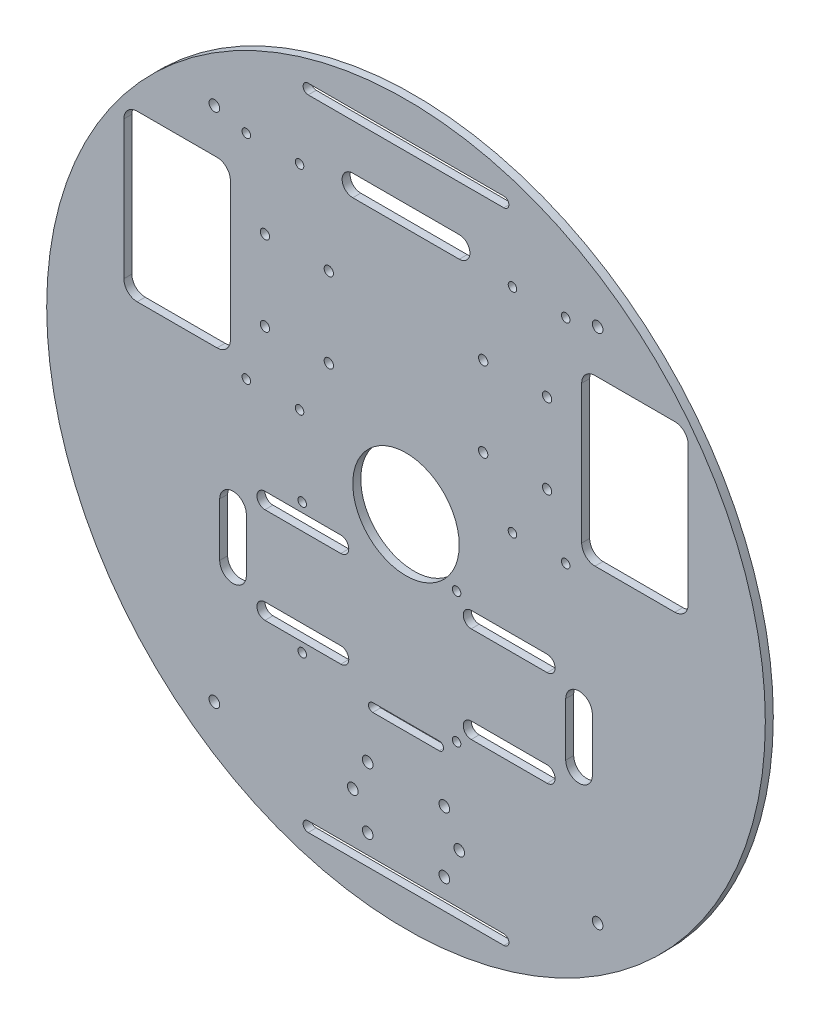
from build123d import *

# Parameters (mm, degrees)
SKETCH_1_R          = 135
SKETCH_1_R_2        = 2
SKETCH_1_W          = 40
SKETCH_1_H          = 62
SKETCH_1_R_3        = 1.75
EXTRUDE_1_DEPTH     = 3
FILLET_1_R          = 5
SKETCH_2_R          = 20
SKETCH_2_R_2        = 2
SKETCH_2_R_3        = 1.6
CUT_EXTRUDE_1_DEPTH = 10


with BuildPart() as part:
    # 草图1 → 凸台-拉伸1 (new body)
    with BuildSketch(Plane.XY):
        Circle(SKETCH_1_R)
        with Locations((-14.4, -110.804246301)):
            Circle(SKETCH_1_R_2, mode=Mode.SUBTRACT)
        with Locations((-20, -99.304246301)):
            Circle(SKETCH_1_R_2, mode=Mode.SUBTRACT)
        with Locations((-14.4, -87.804246301)):
            Circle(SKETCH_1_R_2, mode=Mode.SUBTRACT)
        with Locations((14.4, -110.804246301)):
            Circle(SKETCH_1_R_2, mode=Mode.SUBTRACT)
        with Locations((14.4, -87.804246301)):
            Circle(SKETCH_1_R_2, mode=Mode.SUBTRACT)
        with Locations((20, -99.304246301)):
            Circle(SKETCH_1_R_2, mode=Mode.SUBTRACT)
        with Locations((-86, 49.65212315)):
            Rectangle(SKETCH_1_W, SKETCH_1_H, mode=Mode.SUBTRACT)
        with Locations((-53, 34.65212315)):
            Circle(SKETCH_1_R_3, mode=Mode.SUBTRACT)
        with Locations((-53, 64.65212315)):
            Circle(SKETCH_1_R_3, mode=Mode.SUBTRACT)
        with Locations((-29, 34.65212315)):
            Circle(SKETCH_1_R_3, mode=Mode.SUBTRACT)
        with Locations((-29, 64.65212315)):
            Circle(SKETCH_1_R_3, mode=Mode.SUBTRACT)
        with Locations((29, 34.65212315)):
            Circle(SKETCH_1_R_3, mode=Mode.SUBTRACT)
        with Locations((29, 64.65212315)):
            Circle(SKETCH_1_R_3, mode=Mode.SUBTRACT)
        with Locations((53, 34.65212315)):
            Circle(SKETCH_1_R_3, mode=Mode.SUBTRACT)
        with Locations((53, 64.65212315)):
            Circle(SKETCH_1_R_3, mode=Mode.SUBTRACT)
        with Locations((86, 49.65212315)):
            Rectangle(SKETCH_1_W, SKETCH_1_H, mode=Mode.SUBTRACT)
    extrude(amount=EXTRUDE_1_DEPTH)

    # 圆角1
    fillet_1_edges = [part.edges().sort_by_distance(p)[0] for p in [
        (66, 80.65212315, 1.5),
        (66, 18.65212315, 1.5),
        (106, 18.65212315, 1.5),
        (106, 80.65212315, 1.5),
        (-106, 80.65212315, 1.5),
        (-106, 18.65212315, 1.5),
        (-66, 18.65212315, 1.5),
        (-66, 80.65212315, 1.5),
    ]]
    fillet(fillet_1_edges, radius=FILLET_1_R)

    # 草图2 → 切除-拉伸1 (cut)
    with BuildSketch(Plane.XY.offset(3)):
        Circle(SKETCH_2_R)
        with Locations((-72, 97)):
            Circle(SKETCH_2_R_2)
        with Locations((72, 97)):
            Circle(SKETCH_2_R_2)
        with Locations((72, -97)):
            Circle(SKETCH_2_R_2)
        with Locations((-72, -97)):
            Circle(SKETCH_2_R_2)
        with Locations((-60, 94)):
            Circle(SKETCH_2_R_3)
        with Locations((-60, 14)):
            Circle(SKETCH_2_R_3)
        with Locations((-40, 94)):
            Circle(SKETCH_2_R_3)
        with Locations((-40, 14)):
            Circle(SKETCH_2_R_3)
        with Locations((60, 14)):
            Circle(SKETCH_2_R_3)
        with Locations((60, 94)):
            Circle(SKETCH_2_R_3)
        with Locations((40, 94)):
            Circle(SKETCH_2_R_3)
        with Locations((40, 14)):
            Circle(SKETCH_2_R_3)
        with Locations((-39, -15.5)):
            Circle(SKETCH_2_R_3)
        with Locations((19, -15.5)):
            Circle(SKETCH_2_R_3)
        with Locations((-39, -64.5)):
            Circle(SKETCH_2_R_3)
        with Locations((19, -64.5)):
            Circle(SKETCH_2_R_3)
        with BuildLine():
            Line((24.505636669, -55), (53, -55))
            ThreePointArc((53, -55), (56, -58), (53, -61))
            Line((53, -61), (24.505636669, -61))
            ThreePointArc((24.505636669, -61), (21.505636669, -58), (24.505636669, -55))
        make_face()
        with BuildLine():
            Line((-53, -19), (-24.505636669, -19))
            ThreePointArc((-24.505636669, -19), (-21.505636669, -22), (-24.505636669, -25))
            Line((-24.505636669, -25), (-53, -25))
            ThreePointArc((-53, -25), (-56, -22), (-53, -19))
        make_face()
        with BuildLine():
            Line((-53, -61), (-24.505636669, -61))
            ThreePointArc((-24.505636669, -61), (-21.505636669, -58), (-24.505636669, -55))
            Line((-24.505636669, -55), (-53, -55))
            ThreePointArc((-53, -55), (-56, -58), (-53, -61))
        make_face()
        with BuildLine():
            Line((24.505636669, -25), (53, -25))
            ThreePointArc((53, -25), (56, -22), (53, -19))
            Line((53, -19), (24.505636669, -19))
            ThreePointArc((24.505636669, -19), (21.505636669, -22), (24.505636669, -25))
        make_face()
        with BuildLine():
            Line((-70, -30), (-70, -50))
            ThreePointArc((-70, -50), (-65, -55), (-60, -50))
            Line((-60, -50), (-60, -30))
            ThreePointArc((-60, -30), (-65, -25), (-70, -30))
        make_face()
        with BuildLine():
            Line((60, -30), (60, -50))
            ThreePointArc((60, -50), (65, -55), (70, -50))
            Line((70, -50), (70, -30))
            ThreePointArc((70, -30), (65, -25), (60, -30))
        make_face()
        with BuildLine():
            Line((-36.755588957, 121.9), (36.755588957, 121.9))
            ThreePointArc((36.755588957, 121.9), (38.655588957, 120), (36.755588957, 118.1))
            Line((36.755588957, 118.1), (-36.755588957, 118.1))
            ThreePointArc((-36.755588957, 118.1), (-38.655588957, 120), (-36.755588957, 121.9))
        make_face()
        with BuildLine():
            Line((-36.755588957, -118.1), (36.755588957, -118.1))
            ThreePointArc((36.755588957, -118.1), (38.655588957, -120), (36.755588957, -121.9))
            Line((36.755588957, -121.9), (-36.755588957, -121.9))
            ThreePointArc((-36.755588957, -121.9), (-38.655588957, -120), (-36.755588957, -118.1))
        make_face()
        with BuildLine():
            Line((12.5, -70.7), (-12.5, -70.7))
            ThreePointArc((-12.5, -70.7), (-14.1, -69.1), (-12.5, -67.5))
            Line((-12.5, -67.5), (12.5, -67.5))
            ThreePointArc((12.5, -67.5), (14.1, -69.1), (12.5, -70.7))
        make_face()
        with BuildLine():
            Line((20, 101), (-20, 101))
            ThreePointArc((-20, 101), (-24, 97), (-20, 93))
            Line((-20, 93), (20, 93))
            ThreePointArc((20, 93), (24, 97), (20, 101))
        make_face()
    extrude(amount=-CUT_EXTRUDE_1_DEPTH, mode=Mode.SUBTRACT)


solid = part.part
